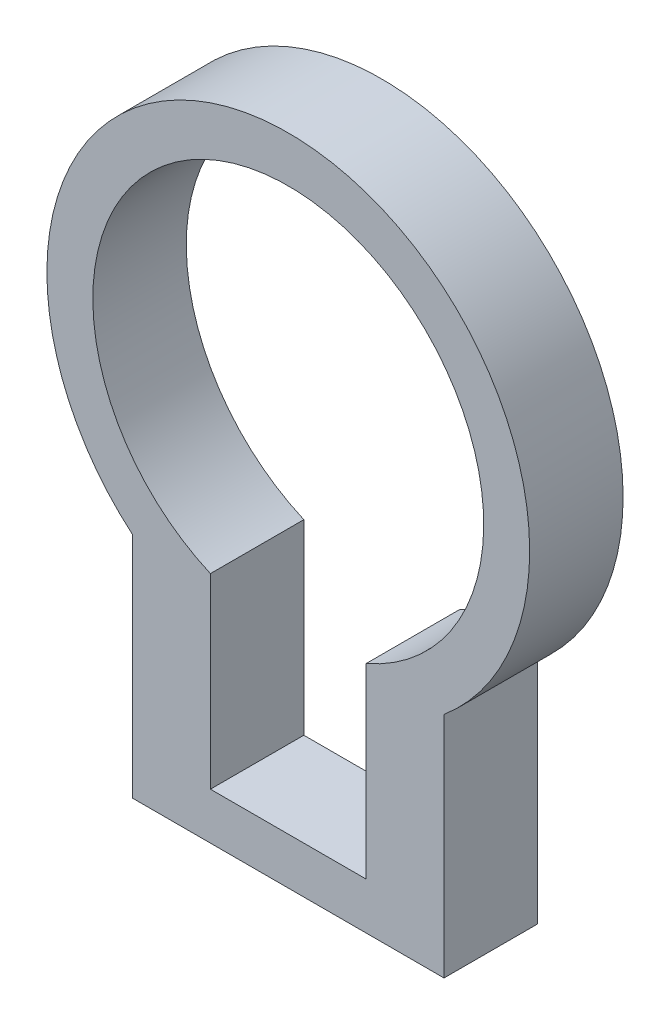
from build123d import *

# Parameters (mm, degrees)
ESQUISSE1_W             = 20
ESQUISSE1_H             = 17
BOSS_EXTRU_1_DEPTH      = 6
ESQUISSE2_R             = 15.5
BOSS_EXTRU_2_DEPTH      = 6
ESQUISSE3_R             = 12.55
ENL_V_MAT_EXTRU_1_DEPTH = 6
ESQUISSE4_W             = 10
ESQUISSE4_H             = 11.989026974
ENL_V_MAT_EXTRU_2_DEPTH = 10


with BuildPart() as part:
    # Esquisse1 → Boss.-Extru.1 (new body)
    with BuildSketch(Plane.XY):
        Rectangle(ESQUISSE1_W, ESQUISSE1_H)
    extrude(amount=BOSS_EXTRU_1_DEPTH)

    # Esquisse2 → Boss.-Extru.2 (add)
    with BuildSketch(Plane.XY.offset(6)):
        with Locations((0, 18)):
            Circle(ESQUISSE2_R)
    extrude(amount=-BOSS_EXTRU_2_DEPTH)

    # Esquisse3 → Enlèv. mat.-Extru.1 (cut)
    with BuildSketch(Plane.XY.offset(6)):
        with Locations((0, 18)):
            Circle(ESQUISSE3_R)
    extrude(amount=-ENL_V_MAT_EXTRU_1_DEPTH, mode=Mode.SUBTRACT)

    # Esquisse4 → Enlèv. mat.-Extru.2 (cut)
    with BuildSketch(Plane.XY.offset(6)):
        with Locations((0, 0.494513487)):
            Rectangle(ESQUISSE4_W, ESQUISSE4_H)
    extrude(amount=-ENL_V_MAT_EXTRU_2_DEPTH, mode=Mode.SUBTRACT)


solid = part.part
